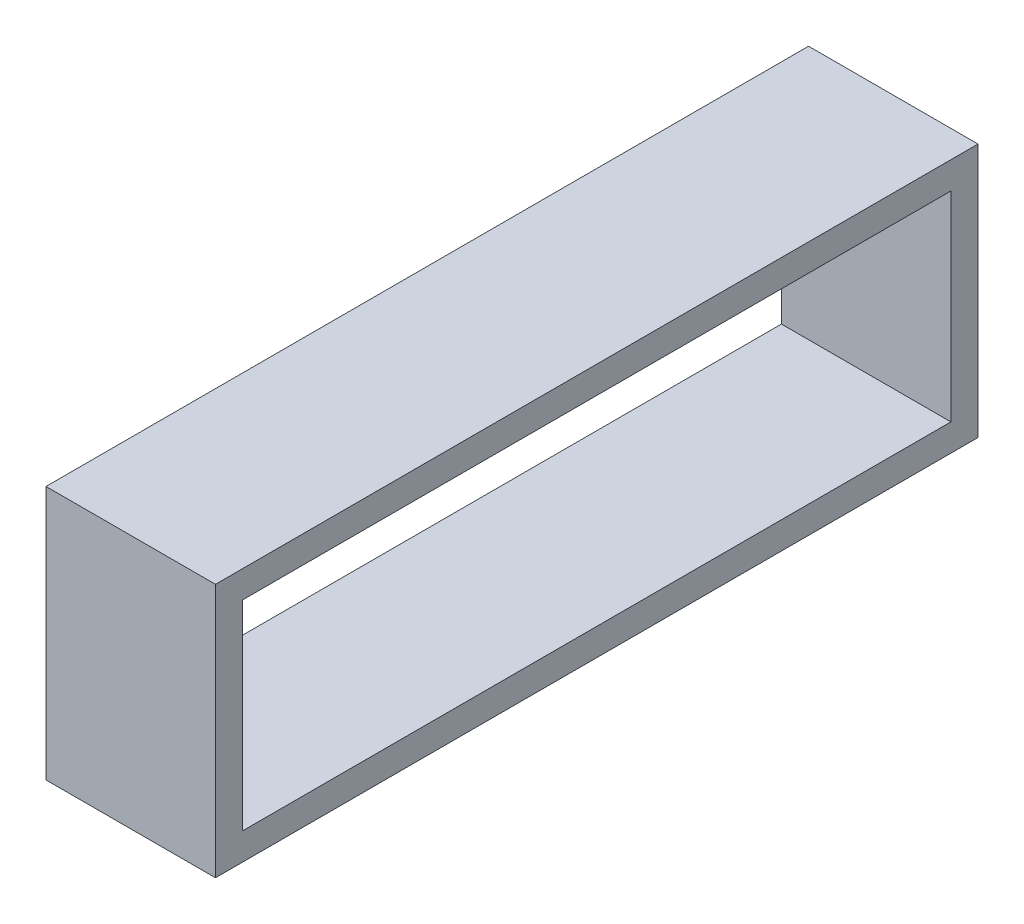
from build123d import *

# Parameters (mm, degrees)
SKETCH1_W           = 12.7
SKETCH1_H           = 19.05
BOSS_EXTRUDE1_DEPTH = 57.15
SKETCH3_W           = 53.086
SKETCH3_H           = 14.986
CUT_EXTRUDE2_DEPTH  = 124.46


with BuildPart() as part:
    # Sketch1 → Boss-Extrude1 (new body)
    with BuildSketch(Plane.XY):
        with Locations((0, -9.525)):
            Rectangle(SKETCH1_W, SKETCH1_H)
    extrude(amount=BOSS_EXTRUDE1_DEPTH)

    # Sketch3 → Cut-Extrude2 (cut)
    with BuildSketch(Plane.ZY.offset(6.35)):
        with Locations((28.575, -9.525)):
            Rectangle(SKETCH3_W, SKETCH3_H)
    extrude(amount=-CUT_EXTRUDE2_DEPTH, mode=Mode.SUBTRACT)


solid = part.part
